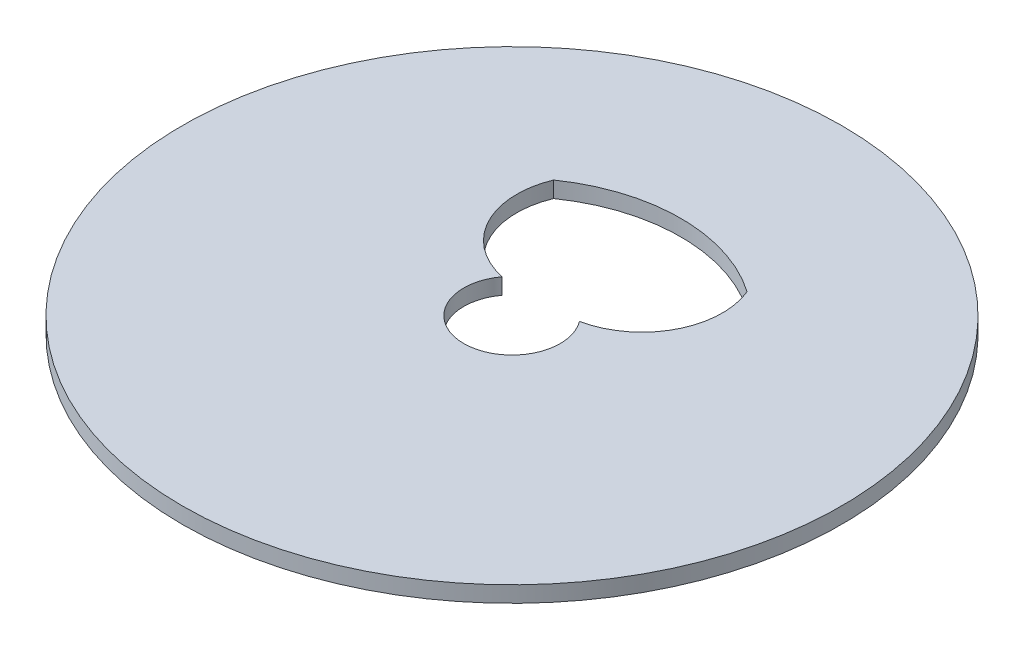
from build123d import *

# Parameters (mm, degrees)
SKETCH1_R           = 41
BOSS_EXTRUDE1_DEPTH = 2


with BuildPart() as part:
    # Sketch1 → Boss-Extrude1 (new body)
    # profile 1 of 2: a face of its own
    with BuildSketch(Plane(origin=(0, 0, 0), x_dir=(1, 0, 0), z_dir=(0, 1, 0))):
        with Locations(Location((0, 0, 0), (0, 0, 270))):
            Circle(SKETCH1_R)
        with BuildLine():
            ThreePointArc((21, 0), (-9.127670618, -18.912578594), (-13.065298009, 16.440741709))
            ThreePointArc((-13.065298009, 16.440741709), (-12.557369181, 16.831888761), (-12.037737576, 17.20734942))
            ThreePointArc((-12.037737576, 17.20734942), (0, 21), (12.037737576, 17.20734942))
            ThreePointArc((12.037737576, 17.20734942), (12.557369181, 16.831888761), (13.065298009, 16.440741709))
            ThreePointArc((13.065298009, 16.440741709), (18.912578594, 9.127670618), (21, 0))
        make_face(mode=Mode.SUBTRACT)
    # profile 2 of 2: a face of its own
    with BuildSketch(Plane(origin=(0, 0, 0), x_dir=(1, 0, 0), z_dir=(0, 1, 0))):
        with BuildLine():
            ThreePointArc((-12.037737576, 17.20734942), (-12.557369181, 16.831888761), (-13.065298009, 16.440741709))
            ThreePointArc((-13.065298009, 16.440741709), (-9.127670618, -18.912578594), (21, 0))
            ThreePointArc((21, 0), (18.912578594, 9.127670618), (13.065298009, 16.440741709))
            ThreePointArc((13.065298009, 16.440741709), (12.557369181, 16.831888761), (12.037737576, 17.20734942))
            ThreePointArc((12.037737576, 17.20734942), (11.628117295, 8.696683132), (4.806650128, 3.591116059))
            ThreePointArc((4.806650128, 3.591116059), (0, -6), (-4.806650128, 3.591116059))
            ThreePointArc((-4.806650128, 3.591116059), (-11.628117295, 8.696683132), (-12.037737576, 17.20734942))
        make_face()
    extrude(amount=BOSS_EXTRUDE1_DEPTH)


solid = part.part
